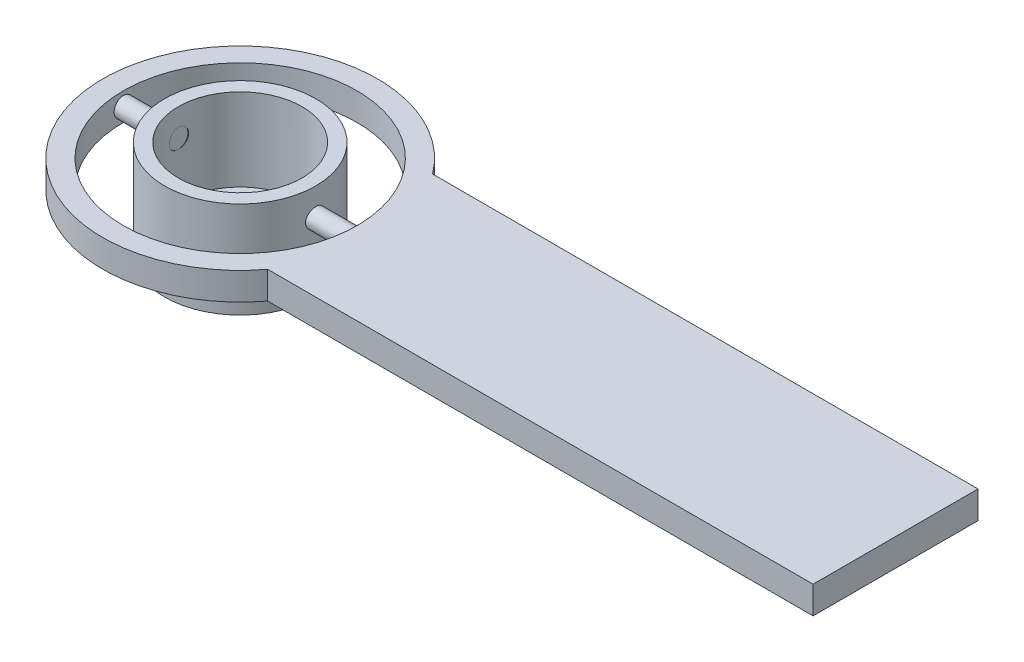
from build123d import *

# Parameters (mm, degrees)
EXTRUDE_THIN1_DEPTH      = 10
EXTRUDE_THIN1_DEPTH_BACK = 25
SKETCH1_R                = 27.5
SKETCH1_R_2              = 22.5
SKETCH3_R                = 22.5
BOSS_EXTRUDE1_DEPTH      = 5
BOSS_EXTRUDE2_DEPTH      = 5
BOSS_EXTRUDE2_DEPTH_BACK = 5
SKETCH1_4_R              = 50
SKETCH1_4_R_2            = 42.5
CUT_EXTRUDE1_REACH       = 220.167
CUT_EXTRUDE1_END_RADIUS  = 22.5
SKETCH5_R                = 3.5
BOSS_EXTRUDE3_REACH      = 205.704
BOSS_EXTRUDE3_END_RADIUS = 22.5
SKETCH6_R                = 3.5
SKETCH7_R                = 3.5
BOSS_EXTRUDE5_DEPTH      = 20


with BuildPart() as part:
    # Sketch1 → Extrude-Thin1 (new, two sides: drawn at the far end of the back side and taken through both)
    with BuildSketch(Plane(origin=(0, 0, 0), x_dir=(1, 0, 0), z_dir=(0, 1, 0)).offset(-EXTRUDE_THIN1_DEPTH_BACK)):
        Circle(SKETCH1_R)
        Circle(SKETCH1_R_2, mode=Mode.SUBTRACT)
    extrude(amount=EXTRUDE_THIN1_DEPTH + EXTRUDE_THIN1_DEPTH_BACK)

    # Sketch3 → Boss-Extrude1 (add)
    with BuildSketch(Plane.XZ.offset(25)):
        with Locations(Location((0, 0, 0), (0, 0, 90))):
            Circle(SKETCH3_R)
    extrude(amount=-BOSS_EXTRUDE1_DEPTH)

    # Cut-Extrude1: up to this cylinder (the profile starts outside it)
    cut_extrude1_end = Plane(origin=(0, 0, 0), z_dir=(0, 1, 0)) * Cylinder(CUT_EXTRUDE1_END_RADIUS, 486.334, mode=Mode.PRIVATE)
    # Sketch5 → Cut-Extrude1 (cut, up to the surface)
    with BuildSketch(Plane(origin=(27.5, 0, 0), x_dir=(0, 0, -1), z_dir=(1, 0, 0)), mode=Mode.PRIVATE) as cut_extrude1_sk1:
        Circle(SKETCH5_R)
    cut_extrude1_tool1 = extrude(cut_extrude1_sk1.sketch, amount=-CUT_EXTRUDE1_REACH, mode=Mode.PRIVATE) - cut_extrude1_end
    cut_extrude1 = cut_extrude1_tool1.solids().sort_by_distance((27.5, 0, 0))[0]
    add(cut_extrude1, mode=Mode.SUBTRACT)

    # Mirror1: Cut-Extrude1 across plane
    add(cut_extrude1.mirror(Plane(origin=(0, 0, 0), x_dir=(0, 0, 1), z_dir=(1, 0, 0))), mode=Mode.SUBTRACT)



with BuildPart() as body_2:
    # Sketch1<4> → Boss-Extrude2 (new, two sides: drawn at the far end of the back side and taken through both)
    # profile 1 of 2: a face of its own
    with BuildSketch(Plane(origin=(0, 0, 0), x_dir=(1, 0, 0), z_dir=(0, 1, 0)).offset(-BOSS_EXTRUDE2_DEPTH_BACK)):
        Circle(SKETCH1_4_R)
        with Locations(Location((0, 0, 0), (0, 0, 270))):
            Circle(SKETCH1_4_R_2, mode=Mode.SUBTRACT)
    # profile 2 of 2: a face of its own
    with BuildSketch(Plane(origin=(0, 0, 0), x_dir=(1, 0, 0), z_dir=(0, 1, 0)).offset(-BOSS_EXTRUDE2_DEPTH_BACK)):
        with BuildLine():
            ThreePointArc((50, 0), (47.434164903, -15.811388301), (40, -30))
            Line((40, -30), (238.383087675, -30))
            Line((238.383087675, -30), (238.383087675, 30))
            Line((238.383087675, 30), (40, 30))
            ThreePointArc((40, 30), (47.434164903, 15.811388301), (50, 0))
        make_face()
    extrude(amount=BOSS_EXTRUDE2_DEPTH + BOSS_EXTRUDE2_DEPTH_BACK)


with BuildPart() as part_1:
    add(part.part)

    add(body_2.part)  # Boss-Extrude3 merges body 2
    # Boss-Extrude3: up to this cylinder (the profile starts outside it)
    boss_extrude3_end = Plane(origin=(0, 0, 0), z_dir=(0, 1, 0)) * Cylinder(BOSS_EXTRUDE3_END_RADIUS, 457.408, mode=Mode.PRIVATE)
    # Sketch6 → Boss-Extrude3 (add, up to the surface)
    with BuildSketch(Plane.ZY.offset(-42.5), mode=Mode.PRIVATE) as boss_extrude3_sk1:
        with Locations(Location((0, 0, 0), (0, 0, 180))):
            Circle(SKETCH6_R)
    boss_extrude3_tool1 = extrude(boss_extrude3_sk1.sketch, amount=BOSS_EXTRUDE3_REACH, mode=Mode.PRIVATE) - boss_extrude3_end
    add(boss_extrude3_tool1.solids().sort_by_distance((42.5, 0, 0))[0])

    # Sketch7 → Boss-Extrude5 (add)
    with BuildSketch(Plane(origin=(-42.5, 0, 0), x_dir=(0, 0, -1), z_dir=(1, 0, 0))):
        Circle(SKETCH7_R)
    extrude(amount=BOSS_EXTRUDE5_DEPTH)


solid = part_1.part
